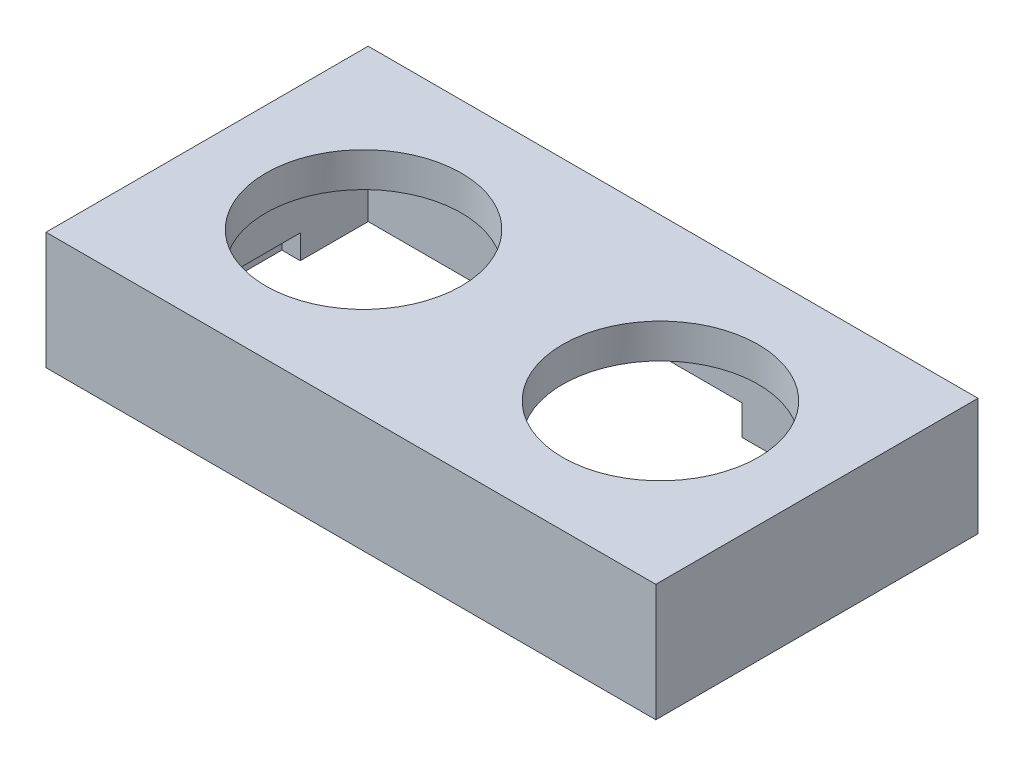
from build123d import *

# Parameters (mm, degrees)
SKETCH2_R           = 3.175
BOSS_EXTRUDE1_DEPTH = 3
SKETCH4_W           = 53
SKETCH4_H           = 25
BOSS_EXTRUDE3_DEPTH = 3
BOSS_EXTRUDE4_DEPTH = 7.2
SKETCH6_R           = 8.5
CUT_EXTRUDE1_DEPTH  = 7.2
SKETCH7_W           = 18
SKETCH7_H           = 6
CUT_EXTRUDE2_DEPTH  = 2.6
SKETCH8_W           = 1.6
SKETCH8_H           = 10.2
CUT_EXTRUDE3_DEPTH  = 2.1
CUT_EXTRUDE4_START  = -3
CUT_EXTRUDE4_DEPTH  = 3


with BuildPart() as part:
    # Sketch2 → Boss-Extrude1 (new body)
    with BuildSketch(Plane.XY):
        with BuildLine():
            Line((26.5, 7.809866434), (26.5, 7.967433715))
            Line((26.5, 7.967433715), (51.343101615, 22.31060512))
            ThreePointArc((51.343101615, 22.31060512), (51.20337497, 29.562282322), (44.993101615, 33.309127748))
            Line((44.993101615, 33.309127748), (18.494003701, 18.009866434))
            Line((18.494003701, 18.009866434), (-18.494003701, 18.009866434))
            Line((-18.494003701, 18.009866434), (-44.993101615, 33.309127748))
            ThreePointArc((-44.993101615, 33.309127748), (-51.20337497, 29.562282322), (-51.343101615, 22.31060512))
            Line((-51.343101615, 22.31060512), (-26.5, 7.967433715))
            Line((-26.5, 7.967433715), (-26.5, 7.809866434))
            Line((-26.5, 7.809866434), (26.5, 7.809866434))
        make_face()
        with Locations((44.704, 25.809866434)):
            Circle(SKETCH2_R, mode=Mode.SUBTRACT)
        with Locations((-44.704, 25.809866434)):
            Circle(SKETCH2_R, mode=Mode.SUBTRACT)
    extrude(amount=BOSS_EXTRUDE1_DEPTH)

    # Sketch4 → Boss-Extrude3 (add)
    with BuildSketch(Plane(origin=(0, 18.009866434, 0), x_dir=(1, 0, 0), z_dir=(0, 1, 0))):
        with Locations((0, -15.5)):
            Rectangle(SKETCH4_W, SKETCH4_H)
    extrude(amount=-BOSS_EXTRUDE3_DEPTH)

    # Sketch5 → Boss-Extrude4 (add)
    with BuildSketch(Plane.XZ.offset(-15.009866434)):
        Polygon((-26.5, 3), (-23.5, 3), (-23.5, 25), (23.5, 25), (23.5, 3), (26.5, 3), (26.5, 28), (-26.5, 28), align=None)
    extrude(amount=BOSS_EXTRUDE4_DEPTH)

    # Sketch6 → Cut-Extrude1 (cut)
    with BuildSketch(Plane.XZ.offset(-15.009866434)):
        with Locations((12.9, 14)):
            Circle(SKETCH6_R)
        with Locations((-12.9, 14)):
            Circle(SKETCH6_R)
    extrude(amount=-CUT_EXTRUDE1_DEPTH, mode=Mode.SUBTRACT)

    # Sketch7 → Cut-Extrude2 (cut)
    with BuildSketch(Plane.XZ.offset(-7.809866434)):
        with Locations((0, 3)):
            Rectangle(SKETCH7_W, SKETCH7_H)
    extrude(amount=-CUT_EXTRUDE2_DEPTH, mode=Mode.SUBTRACT)

    # Sketch8 → Cut-Extrude3 (cut)
    with BuildSketch(Plane.XZ.offset(-7.809866434)):
        with Locations((-24.3, 14)):
            Rectangle(SKETCH8_W, SKETCH8_H)
        with Locations((24.3, 14)):
            Rectangle(SKETCH8_W, SKETCH8_H)
    extrude(amount=-CUT_EXTRUDE3_DEPTH, mode=Mode.SUBTRACT)

    # Sketch11 → Cut-Extrude4 (cut)
    with BuildSketch(Plane.XY.offset(3).offset(CUT_EXTRUDE4_START)):
        with BuildLine():
            Line((-51.343101615, 22.31060512), (-26.5, 7.967433715))
            Line((-26.5, 7.967433715), (-26.5, 18.009866434))
            Line((-26.5, 18.009866434), (-18.494003701, 18.009866434))
            Line((-18.494003701, 18.009866434), (-44.993101615, 33.309127748))
            ThreePointArc((-44.993101615, 33.309127748), (-51.20337497, 29.562282322), (-51.343101615, 22.31060512))
        make_face()
        with BuildLine():
            Line((26.5, 18.009866434), (26.5, 7.967433715))
            Line((26.5, 7.967433715), (51.343101615, 22.31060512))
            ThreePointArc((51.343101615, 22.31060512), (51.20337497, 29.562282322), (44.993101615, 33.309127748))
            Line((44.993101615, 33.309127748), (18.494003701, 18.009866434))
            Line((18.494003701, 18.009866434), (26.5, 18.009866434))
        make_face()
    extrude(amount=CUT_EXTRUDE4_DEPTH, mode=Mode.SUBTRACT)


solid = part.part
